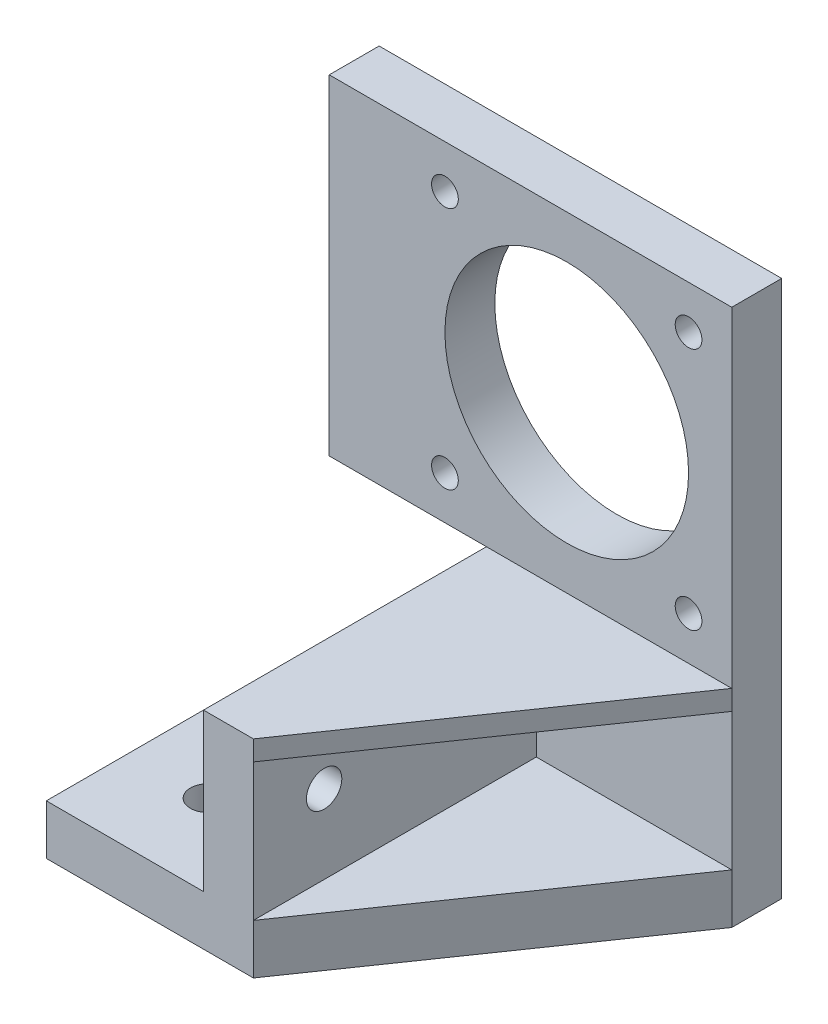
from build123d import *

# Parameters (mm, degrees)
SKETCH2_W            = 6.35
SKETCH2_H            = 20
BOSS_EXTRUDE1_DEPTH  = 42.349999882
SKETCH3_R            = 1.7
SKETCH3_W            = 24.870089154
SKETCH3_H            = 26.35
SKETCH3_W_2          = 9.220089154
SKETCH3_H_2          = 42
BOSS_EXTRUDE2_DEPTH  = 6.35
BOSS_EXTRUDE4_DEPTH  = 6.35
M4_CLEARANCE_HOLE1_D = 4.5
M4_CLEARANCE_HOLE2_D = 4.5
BOSS_EXTRUDE5_DEPTH  = 2.54


with BuildPart() as part:
    # Sketch2 → Boss-Extrude1 (new body)
    with BuildSketch(Plane.XY.offset(114.038644373)):
        Polygon((16.35, -10), (10, -10), (-10, -10), (-10, -16.35), (16.35, -16.35), align=None)
        with Locations((13.175, 0)):
            Rectangle(SKETCH2_W, SKETCH2_H)
    extrude(amount=-BOSS_EXTRUDE1_DEPTH)

    # Sketch3 → Boss-Extrude2 (add)
    # profile 1 of 4: a face of its own
    with BuildSketch(Plane(origin=(0, 0, 71.688644491), x_dir=(-1, 0, 0), z_dir=(0, 0, -1))):
        with BuildLine():
            Line((-41.220089154, 10), (-16.35, 10))
            Line((-16.35, 10), (-16.35, 15.990922415))
            ThreePointArc((-16.35, 15.990922415), (-32.472362042, 40.493777386), (-4.720089154, 31))
            ThreePointArc((-4.720089154, 31), (-7.596369472, 22.006018601), (-15.157728044, 16.35))
            Line((-15.157728044, 16.35), (-6.19233234, 16.35))
            ThreePointArc((-6.19233234, 16.35), (-4.720089154, 17.2), (-3.247845967, 16.35))
            Line((-3.247845967, 16.35), (0.779910846, 16.35))
            Line((0.779910846, 16.35), (0.779910846, 52))
            Line((0.779910846, 52), (-41.220089154, 52))
            Line((-41.220089154, 52), (-41.220089154, 10))
        make_face()
        with Locations((-35.720089154, 15.5)):
            Circle(SKETCH3_R, mode=Mode.SUBTRACT)
        with Locations((-35.720089154, 46.5)):
            Circle(SKETCH3_R, mode=Mode.SUBTRACT)
        with Locations((-4.720089154, 46.5)):
            Circle(SKETCH3_R, mode=Mode.SUBTRACT)
    # profile 2 of 4: a face of its own
    with BuildSketch(Plane(origin=(0, 0, 71.688644491), x_dir=(-1, 0, 0), z_dir=(0, 0, -1))):
        with Locations((-28.785044577, -3.175)):
            Rectangle(SKETCH3_W, SKETCH3_H)
    # profile 3 of 4: a face of its own
    with BuildSketch(Plane(origin=(0, 0, 71.688644491), x_dir=(-1, 0, 0), z_dir=(0, 0, -1))):
        with BuildLine():
            Line((-16.35, 15.990922415), (-16.35, 10))
            Line((-16.35, 10), (-10, 10))
            Line((-10, 10), (0.779910846, 10))
            Line((0.779910846, 10), (0.779910846, 16.35))
            Line((0.779910846, 16.35), (-3.247845967, 16.35))
            ThreePointArc((-3.247845967, 16.35), (-3.078015249, 15.939992377), (-3.020089154, 15.5))
            ThreePointArc((-3.020089154, 15.5), (-5.16008153, 13.857926095), (-6.19233234, 16.35))
            Line((-6.19233234, 16.35), (-15.157728044, 16.35))
            ThreePointArc((-15.157728044, 16.35), (-15.750256819, 16.158483942), (-16.35, 15.990922415))
        make_face()
    # profile 4 of 4: a face of its own
    with BuildSketch(Plane(origin=(0, 0, 71.688644491), x_dir=(-1, 0, 0), z_dir=(0, 0, -1))):
        with Locations((5.389955423, 31)):
            Rectangle(SKETCH3_W_2, SKETCH3_H_2)
    extrude(amount=-BOSS_EXTRUDE2_DEPTH)

    # Sketch4 → Boss-Extrude4 (add)
    with BuildSketch(Plane.XZ.offset(16.35)):
        Polygon((16.35, 114.038644373), (41.220089154, 78.038644491), (16.35, 78.038644491), align=None)
    extrude(amount=-BOSS_EXTRUDE4_DEPTH)

    # M4 Clearance Hole1 (through all)
    with Locations(Plane(origin=(16.35, 0, 0), x_dir=(0, 0, -1), z_dir=(1, 0, 0))):
        with Locations((-105.038644403, 0), (-87.038644462, 0)):
            Hole(M4_CLEARANCE_HOLE1_D / 2)

    # M4 Clearance Hole2 (through all)
    with Locations(Plane(origin=(0, -16.35, 0), x_dir=(-1, 0, 0), z_dir=(0, -1, 0))):
        with Locations((0, -82.276144462), (0, -103.451144403)):
            Hole(M4_CLEARANCE_HOLE2_D / 2)

    # Sketch11 → Boss-Extrude5 (add)
    with BuildSketch(Plane(origin=(0, 10, 0), x_dir=(1, 0, 0), z_dir=(0, 1, 0))):
        Polygon((16.35, -114.038644373), (41.220089154, -78.038644491), (16.35, -78.038644491), align=None)
    extrude(amount=-BOSS_EXTRUDE5_DEPTH)


solid = part.part
